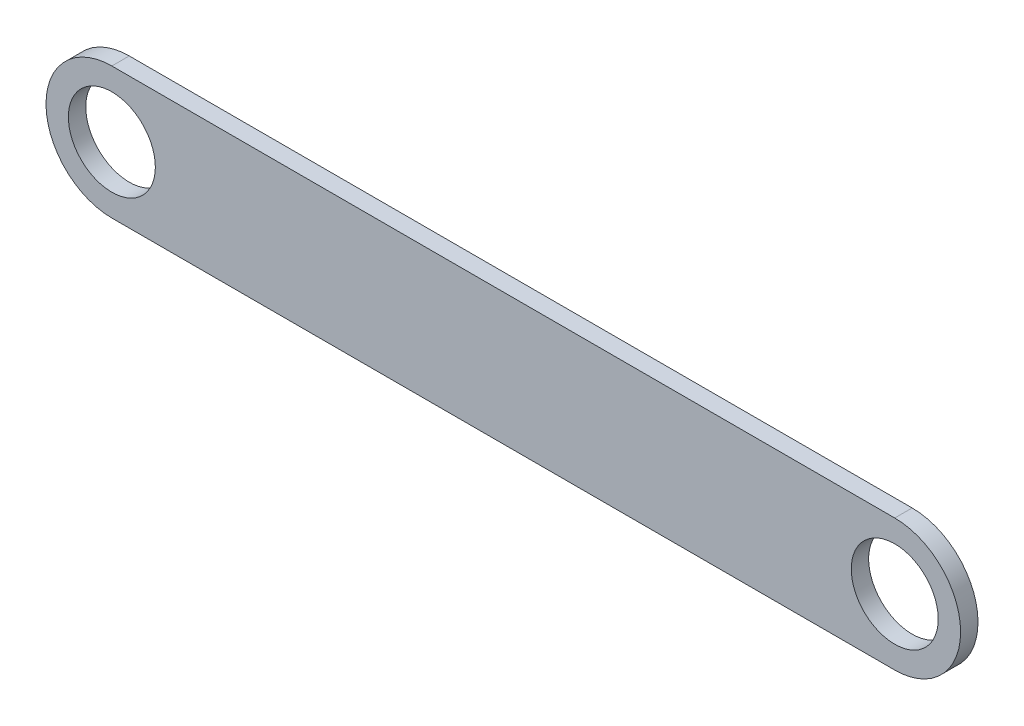
from build123d import *

# Parameters (mm, degrees)
BOSS_EXTRUDE1_DEPTH = 10
SKETCH2_R           = 25
CUT_EXTRUDE1_DEPTH  = 10


with BuildPart() as part:
    # Sketch1 → Boss-Extrude1 (new body)
    with BuildSketch(Plane.XY):
        with BuildLine():
            Line((-225, 37.85046729), (225, 37.85046729))
            ThreePointArc((225, 37.85046729), (262.85046729, 0), (225, -37.85046729))
            Line((225, -37.85046729), (-225, -37.85046729))
            ThreePointArc((-225, -37.85046729), (-262.85046729, 0), (-225, 37.85046729))
        make_face()
    extrude(amount=BOSS_EXTRUDE1_DEPTH)

    # Sketch2 → Cut-Extrude1 (cut)
    with BuildSketch(Plane.XY.offset(10)):
        with Locations((-225, 0)):
            Circle(SKETCH2_R)
        with Locations((225, 0)):
            Circle(SKETCH2_R)
    extrude(amount=-CUT_EXTRUDE1_DEPTH, mode=Mode.SUBTRACT)


solid = part.part
